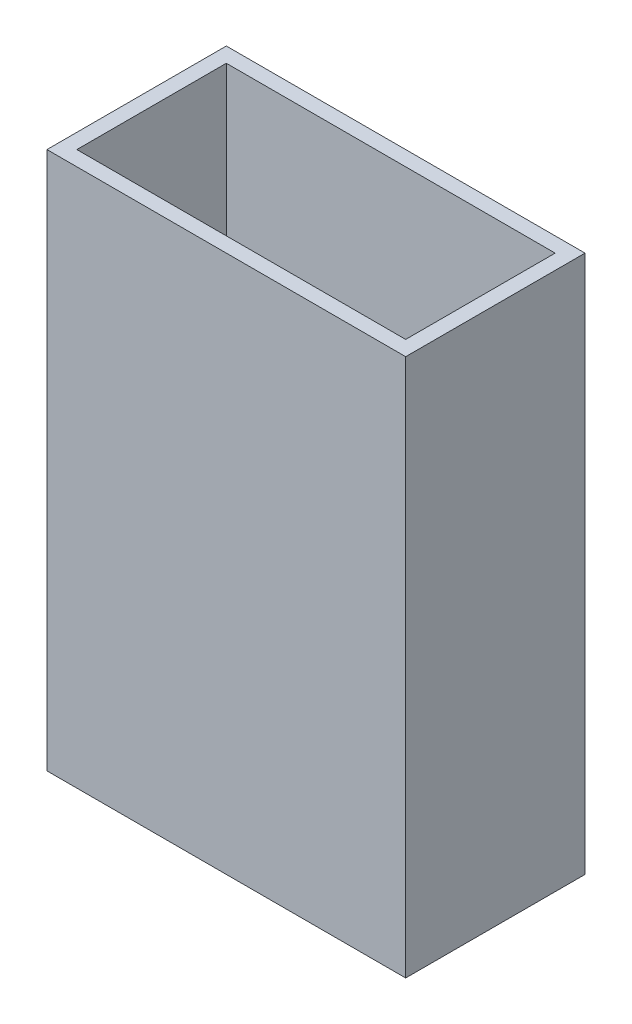
from build123d import *

# Parameters (mm, degrees)
SKETCH1_W           = 152.4
SKETCH1_H           = 228.6
BOSS_EXTRUDE1_DEPTH = 76.2
SHELL1_T            = -6.35


with BuildPart() as part:
    # Sketch1 → Boss-Extrude1 (new body)
    with BuildSketch(Plane.XY):
        with Locations((76.2, 114.3)):
            Rectangle(SKETCH1_W, SKETCH1_H)
    extrude(amount=BOSS_EXTRUDE1_DEPTH)

    # Shell1
    shell1_openings = [part.faces().sort_by_distance(p)[0] for p in [
        (76.2, 228.6, 38.1),
    ]]
    offset(amount=SHELL1_T, openings=shell1_openings, kind=Kind.INTERSECTION)


solid = part.part
